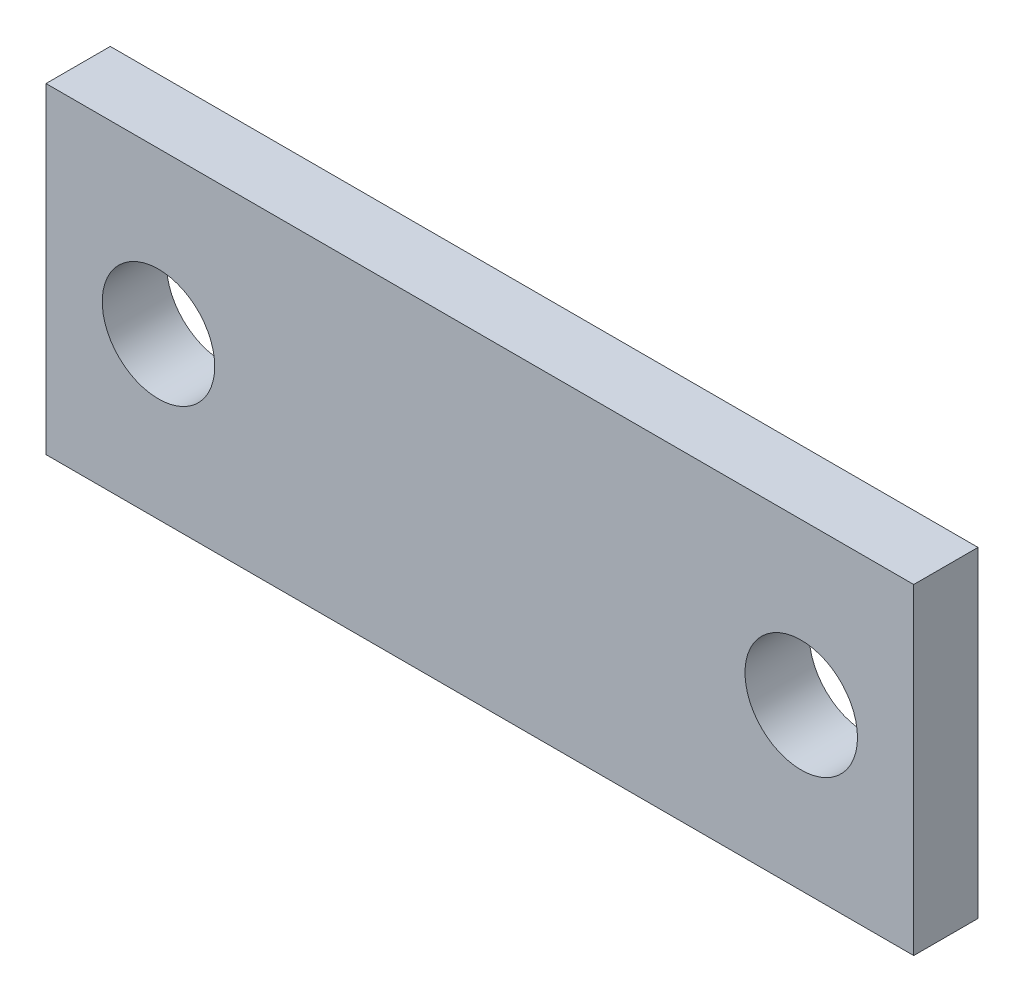
from build123d import *

# Parameters (mm, degrees)
ESQUISSE1_W        = 27
ESQUISSE1_H        = 10
ESQUISSE1_R        = 1.75
BOSS_EXTRU_1_DEPTH = 2


with BuildPart() as part:
    # Esquisse1 → Boss.-Extru.1 (new body)
    with BuildSketch(Plane.XY):
        Rectangle(ESQUISSE1_W, ESQUISSE1_H)
        with Locations((-10, 0)):
            Circle(ESQUISSE1_R, mode=Mode.SUBTRACT)
        with Locations((10, 0)):
            Circle(ESQUISSE1_R, mode=Mode.SUBTRACT)
    extrude(amount=BOSS_EXTRU_1_DEPTH)


solid = part.part
